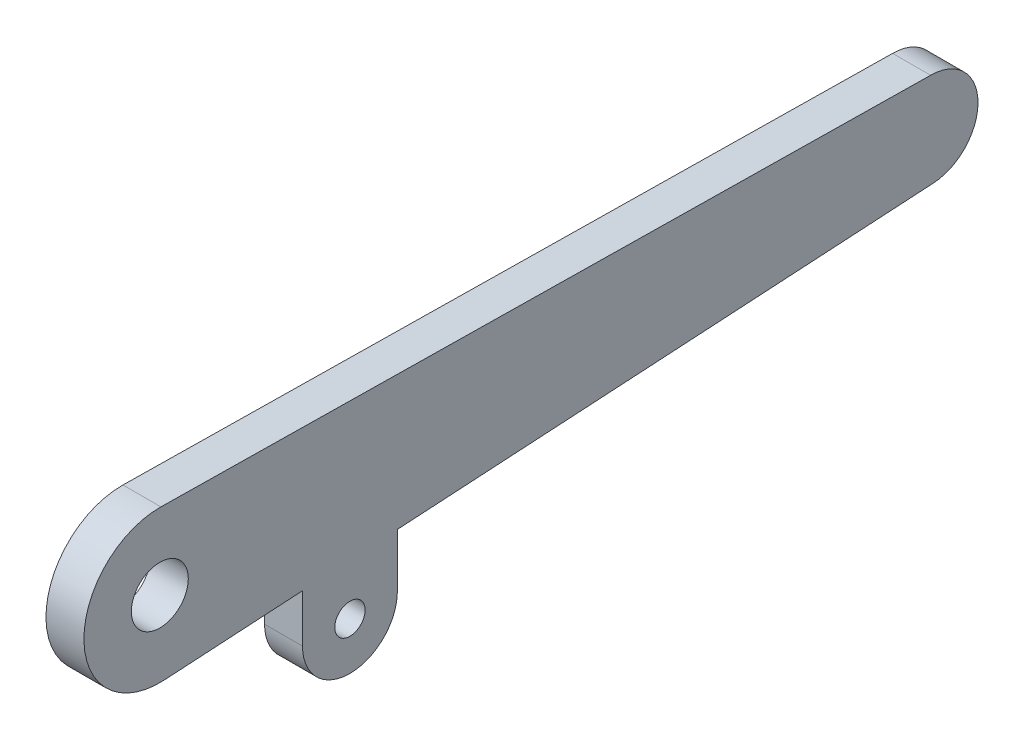
from build123d import *

# Parameters (mm, degrees)
SKETCH1_R           = 1.6
SKETCH1_R_2         = 3
BOSS_EXTRUDE1_DEPTH = 4


with BuildPart() as part:
    # Sketch1 → Boss-Extrude1 (new body)
    with BuildSketch(Plane(origin=(0, 0, 0), x_dir=(0, 0, -1), z_dir=(1, 0, 0))):
        with BuildLine():
            Line((0.115012364, 7.999173217), (81.245547141, 6.832675837))
            ThreePointArc((81.245547141, 6.832675837), (86.243336319, 1.981347724), (81.54275944, -3.158482831))
            Line((81.54275944, -3.158482831), (25.037563857, -6.523240441))
            Line((25.037563857, -6.523240441), (25.037563857, -12.17359421))
            ThreePointArc((25.037563857, -12.17359421), (20.037563857, -17.17359421), (15.037563857, -12.17359421))
            Line((15.037563857, -12.17359421), (15.037563857, -7.118718003))
            Line((15.037563857, -7.118718003), (0.475539679, -7.985853869))
            ThreePointArc((0.475539679, -7.985853869), (-7.997966033, -0.180386633), (0.115012364, 7.999173217))
        make_face()
        with Locations((20.037563857, -12.17359421)):
            Circle(SKETCH1_R, mode=Mode.SUBTRACT)
        Circle(SKETCH1_R_2, mode=Mode.SUBTRACT)
    extrude(amount=BOSS_EXTRUDE1_DEPTH)


solid = part.part
